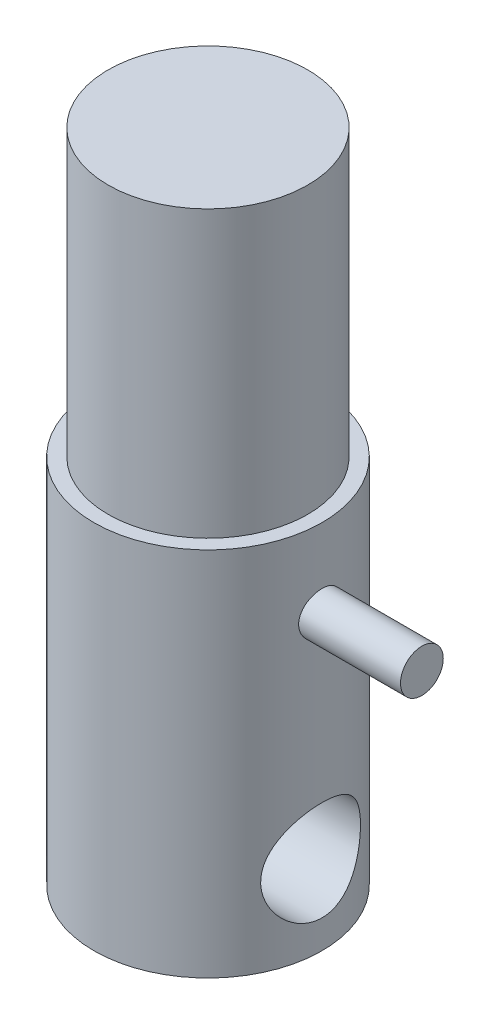
from build123d import *

# Parameters (mm, degrees)
SKETCH2_R               = 8
BOSS_EXTRUDE1_DEPTH     = 26
CUT_EXTRUDE1_DEPTH      = 29.354893758
CUT_EXTRUDE1_DEPTH_BACK = 29.354893758
SKETCH3_R               = 3.5
SKETCH4_R               = 1.5
BOSS_EXTRUDE2_DEPTH     = 15
SKETCH6_R               = 7
BOSS_EXTRUDE3_DEPTH     = 20


with BuildPart() as part:
    # Sketch2 → Boss-Extrude1 (new body)
    with BuildSketch(Plane(origin=(0, 0, 0), x_dir=(1, 0, 0), z_dir=(0, 1, 0))):
        with Locations(Location((0, 0, 0), (0, 0, 90))):
            Circle(SKETCH2_R)
    extrude(amount=BOSS_EXTRUDE1_DEPTH)

    # Sketch3 → Cut-Extrude1 (cut, two sides: drawn at the far end of the back side and taken through both)
    with BuildSketch(Plane(origin=(0, 0, 0), x_dir=(0, 0, -1), z_dir=(1, 0, 0)).offset(-CUT_EXTRUDE1_DEPTH_BACK)):
        with Locations((0, 5.5)):
            Circle(SKETCH3_R)
    extrude(amount=CUT_EXTRUDE1_DEPTH + CUT_EXTRUDE1_DEPTH_BACK, mode=Mode.SUBTRACT)

    # Sketch4 → Boss-Extrude2 (add)
    with BuildSketch(Plane(origin=(0, 0, 0), x_dir=(0, 0, -1), z_dir=(1, 0, 0))):
        with Locations(Location((0, 20.5, 0), (0, 0, 180))):
            Circle(SKETCH4_R)
    extrude(amount=BOSS_EXTRUDE2_DEPTH)

    # Sketch6 → Boss-Extrude3 (add)
    with BuildSketch(Plane(origin=(0, 26, 0), x_dir=(1, 0, 0), z_dir=(0, 1, 0))):
        with Locations(Location((0, 0, 0), (0, 0, 270))):
            Circle(SKETCH6_R)
    extrude(amount=BOSS_EXTRUDE3_DEPTH)


solid = part.part
